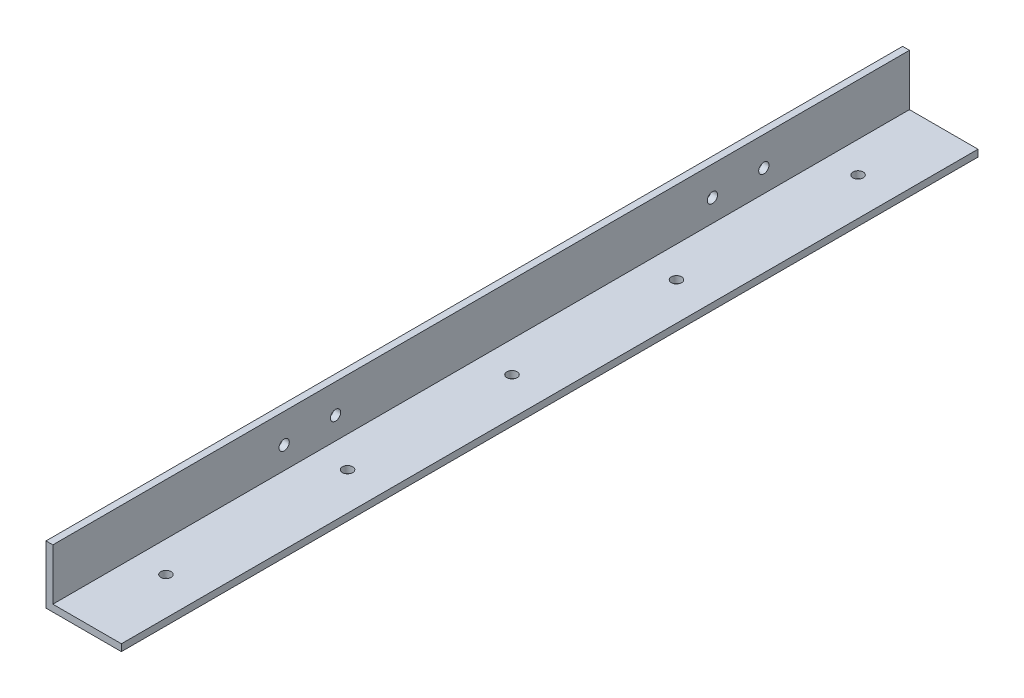
from build123d import *

# Parameters (mm, degrees)
BOSS_EXTRUDE1_DEPTH = 250
SKETCH2_R           = 1.5
CUT_EXTRUDE1_DEPTH  = 20
SKETCH3_R           = 1.5
CUT_EXTRUDE2_DEPTH  = 10


with BuildPart() as part:
    # Sketch1 → Boss-Extrude1 (new body)
    with BuildSketch(Plane.XY):
        Polygon((0, 0), (0, 17), (2, 17), (2, 2), (22, 2), (22, 0), align=None)
    extrude(amount=-BOSS_EXTRUDE1_DEPTH)

    # Sketch2 → Cut-Extrude1 (cut)
    with BuildSketch(Plane(origin=(0, 2, 0), x_dir=(1, 0, 0), z_dir=(0, 1, 0))):
        with Locations(Location((11, 226, 0), (0, 0, 270))):
            Circle(SKETCH2_R)
        with Locations(Location((11, 24, 0), (0, 0, 90))):
            Circle(SKETCH2_R)
        with Locations(Location((11, 125, 0), (0, 0, 270))):
            Circle(SKETCH2_R)
        with Locations(Location((11, 173, 0), (0, 0, 270))):
            Circle(SKETCH2_R)
        with Locations(Location((11, 77, 0), (0, 0, 270))):
            Circle(SKETCH2_R)
    extrude(amount=-CUT_EXTRUDE1_DEPTH, mode=Mode.SUBTRACT)

    # Sketch3 → Cut-Extrude2 (cut)
    with BuildSketch(Plane.ZY):
        with Locations((-207.5, 8.5)):
            Circle(SKETCH3_R)
        with Locations((-192.5, 8.5)):
            Circle(SKETCH3_R)
        with Locations((-67.5, 8.5)):
            Circle(SKETCH3_R)
        with Locations((-82.5, 8.5)):
            Circle(SKETCH3_R)
    extrude(amount=-CUT_EXTRUDE2_DEPTH, mode=Mode.SUBTRACT)


solid = part.part
